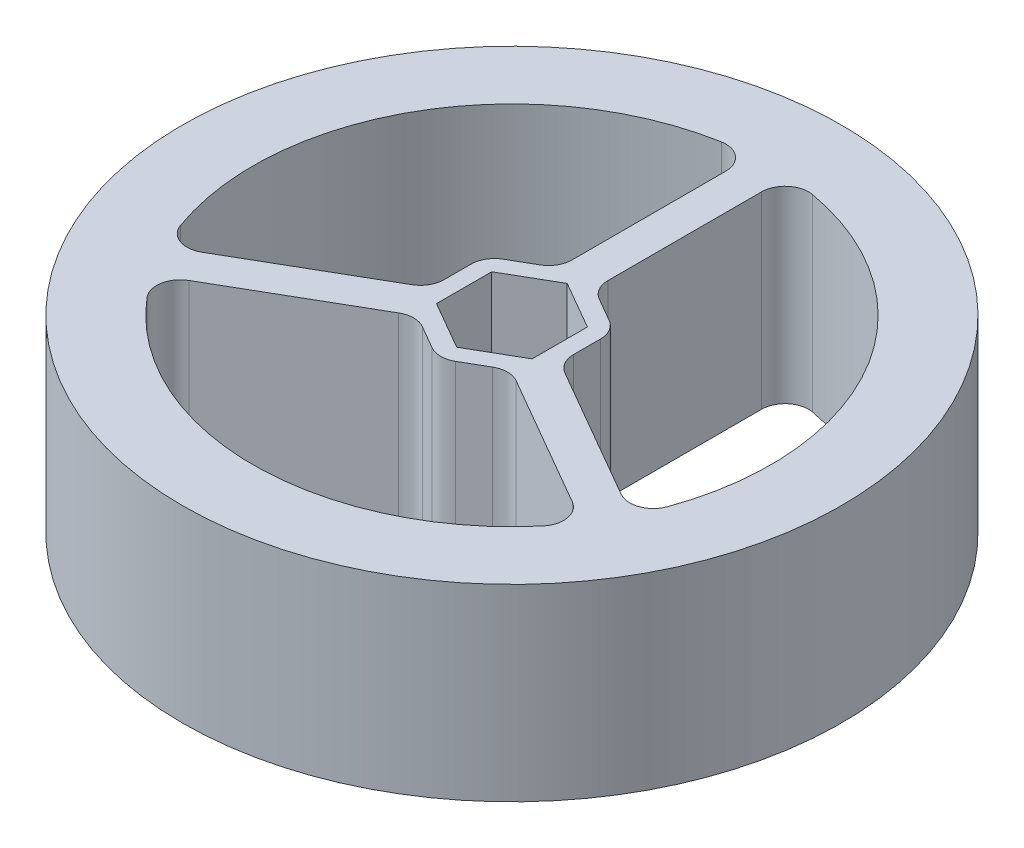
from build123d import *

# Parameters (mm, degrees)
SKETCH1_R           = 44.45
BOSS_EXTRUDE1_DEPTH = 25.4
FILLET1_R           = 3.175


with BuildPart() as part:
    # Sketch1 → Boss-Extrude1 (new body)
    with BuildSketch(Plane(origin=(0, 0, 0), x_dir=(1, 0, 0), z_dir=(0, 1, 0))):
        with Locations(Location((0, 0, 0), (0, 0, 270))):
            Circle(SKETCH1_R)
        Polygon((-6.4516, 3.724832997), (0, 7.449665993), (6.4516, 3.724832997), (6.4516, -3.724832997), (0, -7.449665993), (-6.4516, -3.724832997), align=None, mode=Mode.SUBTRACT)
        with BuildLine():
            Line((2.413, 8.696165225), (2.413, 34.841542101))
            ThreePointArc((2.413, 34.841542101), (30.245937227, 17.4625), (31.380160567, -15.331051751))
            Line((31.380160567, -15.331051751), (8.7376, -2.258363313))
            Line((8.7376, -2.258363313), (8.7376, 5.044655712))
            Line((8.7376, 5.044655712), (2.413, 8.696165225))
        make_face(mode=Mode.SUBTRACT)
        with BuildLine():
            Line((-2.413, 34.841542101), (-2.413, 8.696165225))
            Line((-2.413, 8.696165225), (-8.7376, 5.044655712))
            Line((-8.7376, 5.044655712), (-8.7376, -2.258363313))
            Line((-8.7376, -2.258363313), (-31.380160567, -15.331051751))
            ThreePointArc((-31.380160567, -15.331051751), (-30.245937227, 17.4625), (-2.413, 34.841542101))
        make_face(mode=Mode.SUBTRACT)
        with BuildLine():
            Line((-28.967160567, -19.51049035), (-6.3246, -6.437801912))
            Line((-6.3246, -6.437801912), (0, -10.089311424))
            Line((0, -10.089311424), (6.3246, -6.437801912))
            Line((6.3246, -6.437801912), (28.967160567, -19.51049035))
            ThreePointArc((28.967160567, -19.51049035), (0, -34.925), (-28.967160567, -19.51049035))
        make_face(mode=Mode.SUBTRACT)
    extrude(amount=BOSS_EXTRUDE1_DEPTH)

    # Fillet1
    fillet1_edges = [part.edges().sort_by_distance(p)[0] for p in [
        (-8.7376, 12.7, -5.044655712),
        (-2.413, 12.7, -8.696165225),
        (-2.413, 12.7, -34.841542101),
        (-31.380160567, 12.7, 15.331051751),
        (-8.7376, 12.7, 2.258363313),
        (31.380160567, 12.7, 15.331051751),
        (2.413, 12.7, -34.841542101),
        (2.413, 12.7, -8.696165225),
        (8.7376, 12.7, -5.044655712),
        (8.7376, 12.7, 2.258363313),
        (-28.967160567, 12.7, 19.51049035),
        (28.967160567, 12.7, 19.51049035),
        (6.3246, 12.7, 6.437801912),
        (0, 12.7, 10.089311424),
        (-6.3246, 12.7, 6.437801912),
    ]]
    fillet(fillet1_edges, radius=FILLET1_R)


solid = part.part
